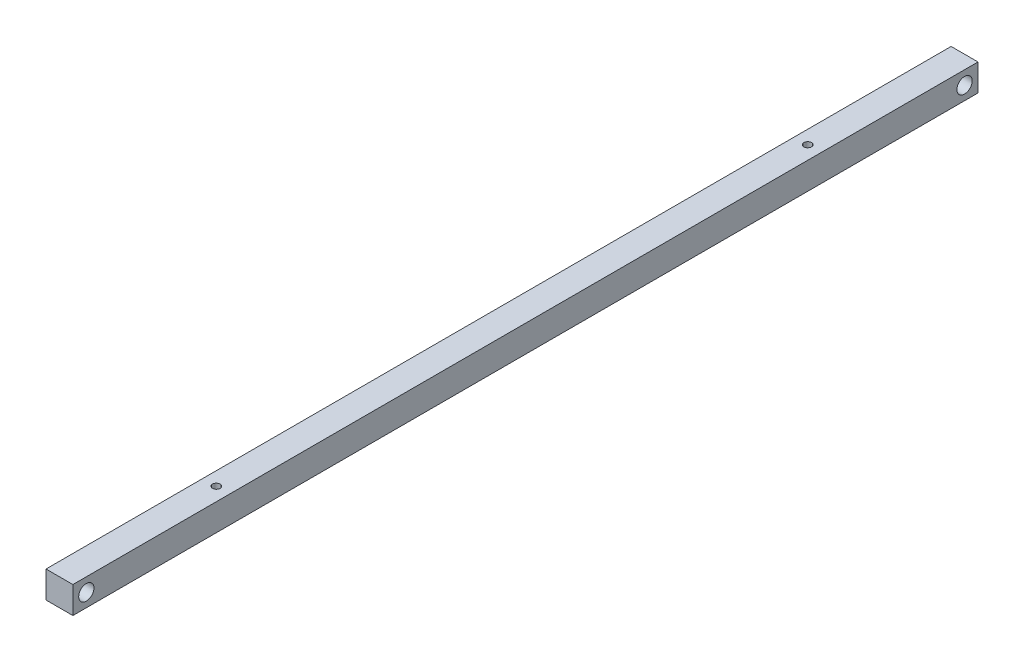
from build123d import *

# Parameters (mm, degrees)
IZIM1_W                     = 15
IZIM1_H                     = 15
Y_KSEKLIK_EKSTR_ZYON1_DEPTH = 252.5
DELIK2_D                    = 8.5
DELIK2_CBORE_D              = 14
DELIK2_CBORE_DEPTH          = 8
M5_DI_LI_DELIK1_D           = 4.2
M5_DI_LI_DELIK1_CSINK_D     = 5.05
M5_DI_LI_DELIK1_CSINK_ANGLE = 90


with BuildPart() as part:
    # Çizim1 → Yükseklik-Ekstrüzyon1 (new, symmetric)
    with BuildSketch(Plane.XY):
        Rectangle(IZIM1_W, IZIM1_H)
    extrude(amount=Y_KSEKLIK_EKSTR_ZYON1_DEPTH, both=True)

    # Delik2 (through all)
    with Locations(Plane(origin=(-7.5, 0, 245), x_dir=(0, 0, -1), z_dir=(-1, 0, 0))):
        with Locations((0, 0)):
            delik2 = CounterBoreHole(DELIK2_D / 2, DELIK2_CBORE_D / 2, DELIK2_CBORE_DEPTH)

    # Aynalama1: Delik2 across plane
    add(delik2.mirror(Plane.XY), mode=Mode.SUBTRACT)

    # M5 Dişli Delik1 (through all)
    with Locations(Plane(origin=(0, -7.5, 0), x_dir=(-1, 0, 0), z_dir=(0, -1, 0))):
        with Locations((0, -165)):
            m5_di_li_delik1 = CounterSinkHole(M5_DI_LI_DELIK1_D / 2, M5_DI_LI_DELIK1_CSINK_D / 2, counter_sink_angle=M5_DI_LI_DELIK1_CSINK_ANGLE)

    # Aynalama2: M5 Dişli Delik1 across plane
    add(m5_di_li_delik1.mirror(Plane.XY), mode=Mode.SUBTRACT)


solid = part.part
